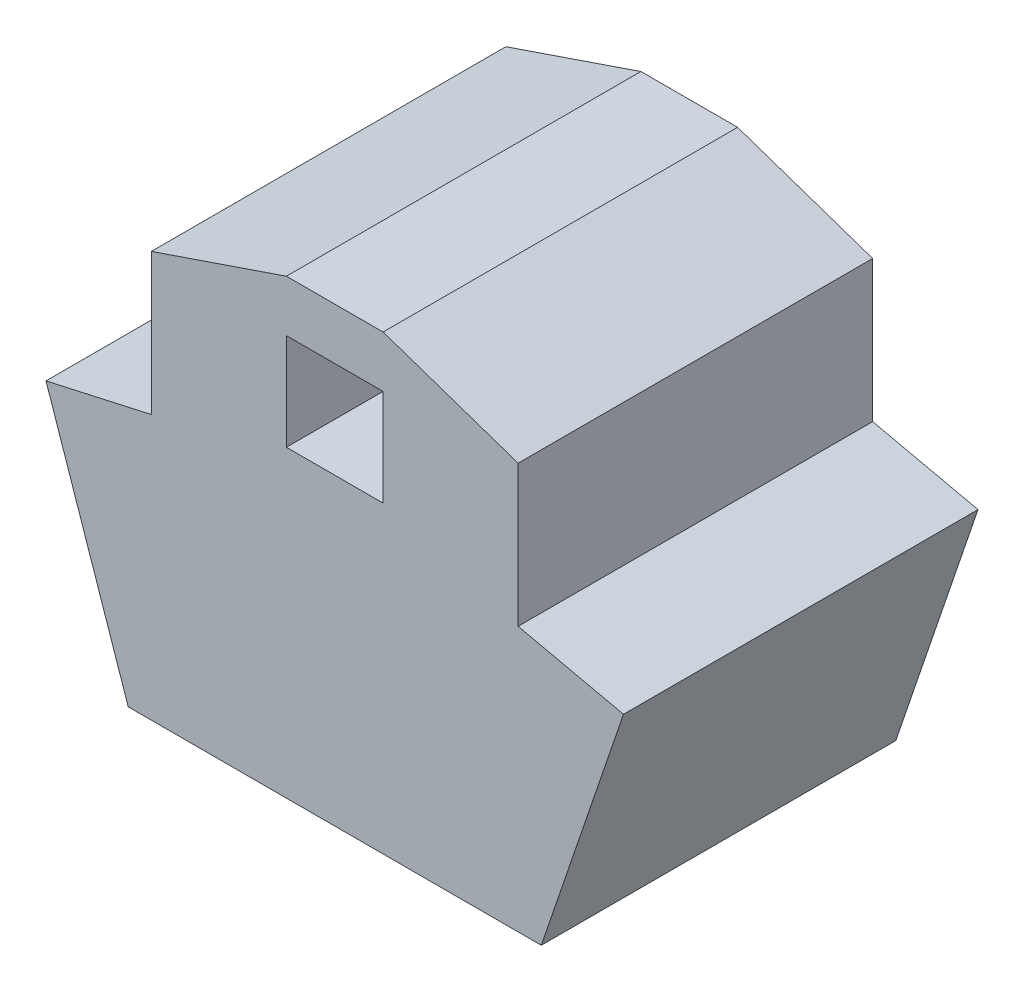
from build123d import *

# Parameters (mm, degrees)
SKETCH1_W                      = 20.045
SKETCH1_H                      = 20.045
BOSS_EXTRUDE1_DEPTH            = 73.5
CUT_EXTRUDE2_DEPTH             = 108.652129543
SKETCH3_RX                     = 9
SKETCH3_RY                     = 5
CUT_EXTRUDE4_DEPTH             = 108.652129543
CUT_EXTRUDE5_DEPTH             = 108.652129714
CUT_EXTRUDE5_DEPTH_BACK        = 108.652129714
SKETCH4_R                      = 7
SKETCH5_R                      = 7
CUT_EXTRUDE6_DEPTH             = 10
CUT_EXTRUDE7_START             = -10
SKETCH6_R                      = 7
CUT_EXTRUDE7_DEPTH             = 10
SKETCH7_R                      = 7.5
CUT_EXTRUDE8_DEPTH             = 10
SKETCH8_R                      = 7
CUT_EXTRUDE9_DEPTH             = 108.652129714
CUT_EXTRUDE9_DIRECTION_2_REACH = 109.652
SKETCH9_R                      = 2.75
CUT_EXTRUDE10_DEPTH            = 15
SKETCH10_R                     = 5.1
CUT_EXTRUDE11_DEPTH            = 4
SKETCH11_W                     = 20.045
SKETCH11_H                     = 20.045
BOSS_EXTRUDE2_DEPTH            = 73.5


with BuildPart() as part:
    # Sketch1 → Boss-Extrude1 (new body)
    with BuildSketch(Plane.XY):
        Polygon((59.861803254, -23.0225), (50.316348709, -51.0225), (-50.316348709, -51.0225), (-59.861803254, -23.0225), (-38.0225, -18.146810718), (-38.0225, 11.146810718), (-10.0225, 20.692265263), (0, 20.692265263), (10.0225, 20.692265263), (38.0225, 11.146810718), (38.0225, -18.146810718), align=None)
        Rectangle(SKETCH1_W, SKETCH1_H, mode=Mode.SUBTRACT)
        Polygon((-12.5, -26.0225), (12.5, -26.0225), (20, -48.0225), (-20, -48.0225), align=None, mode=Mode.SUBTRACT)
        Polygon((15.669537991, -26.0225), (23.169537991, -48.0225), (48.169537991, -48.0225), (55.669537991, -26.0225), align=None, mode=Mode.SUBTRACT)
        Polygon((-15.669537991, -26.0225), (-55.669537991, -26.0225), (-48.169537991, -48.0225), (-23.169537991, -48.0225), align=None, mode=Mode.SUBTRACT)
        Polygon((-13.0225, -23.5), (-13.0225, 16.5), (-35.0225, 9), (-35.0225, -16), align=None, mode=Mode.SUBTRACT)
        Polygon((35.0225, 9), (35.0225, -16), (13.0225, -23.5), (13.0225, 16.5), align=None, mode=Mode.SUBTRACT)
    extrude(amount=BOSS_EXTRUDE1_DEPTH)

    # Sketch2 → Cut-Extrude2 (cut, through all)
    with BuildSketch(Plane.XY):
        Polygon((-17.68804096, -24.0225), (-55.162041129, -24.0225), (-32.517435529, -18.967024579), align=None)
        Polygon((17.68804096, -24.0225), (55.162041129, -24.0225), (32.517435529, -18.967024579), align=None)
    extrude(amount=CUT_EXTRUDE2_DEPTH, mode=Mode.SUBTRACT)

    # Sketch3 → Cut-Extrude4 (cut, through all)
    with BuildSketch(Plane.XY):
        with Locations((0, -18)):
            Ellipse(SKETCH3_RX, SKETCH3_RY)
    extrude(amount=CUT_EXTRUDE4_DEPTH, mode=Mode.SUBTRACT)

    # Sketch4 → Cut-Extrude5 (cut, two sides: drawn at the far end of the back side and taken through both)
    with BuildSketch(Plane(origin=(0, 0, 0), x_dir=(0, 0, -1), z_dir=(1, 0, 0)).offset(-CUT_EXTRUDE5_DEPTH_BACK)):
        with Locations(Location((-36.75, -36.52, 0), (0, 0, 270))):
            Circle(SKETCH4_R)
        with Locations(Location((-58.75, -36.52, 0), (0, 0, 270))):
            Circle(SKETCH4_R)
        with Locations(Location((-14.75, -36.52, 0), (0, 0, 270))):
            Circle(SKETCH4_R)
    extrude(amount=CUT_EXTRUDE5_DEPTH + CUT_EXTRUDE5_DEPTH_BACK, mode=Mode.SUBTRACT)

    # Sketch5 → Cut-Extrude6 (cut)
    with BuildSketch(Plane(origin=(38.0225, 0, 0), x_dir=(0, 0, -1), z_dir=(1, 0, 0))):
        with Locations(Location((-36.75, -3.5, 0), (0, 0, 90))):
            Circle(SKETCH5_R)
        with Locations(Location((-14.75, -3.5, 0), (0, 0, 90))):
            Circle(SKETCH5_R)
        with Locations(Location((-58.75, -3.5, 0), (0, 0, 90))):
            Circle(SKETCH5_R)
    extrude(amount=-CUT_EXTRUDE6_DEPTH, mode=Mode.SUBTRACT)

    # Sketch6 → Cut-Extrude7 (cut)
    with BuildSketch(Plane.ZY.offset(38.0225).offset(CUT_EXTRUDE7_START)):
        with Locations(Location((36.75, -3.5, 0), (0, 0, 90))):
            Circle(SKETCH6_R)
        with Locations(Location((58.75, -3.5, 0), (0, 0, 90))):
            Circle(SKETCH6_R)
        with Locations(Location((14.75, -3.5, 0), (0, 0, 90))):
            Circle(SKETCH6_R)
    extrude(amount=CUT_EXTRUDE7_DEPTH, mode=Mode.SUBTRACT)

    # Sketch7 → Cut-Extrude8 (cut)
    with BuildSketch(Plane.XZ.offset(51.0225)):
        with Locations((0, 36.75)):
            Circle(SKETCH7_R)
        with Locations((35.16, 36.75)):
            Circle(SKETCH7_R)
        with Locations((-35.16, 36.75)):
            Circle(SKETCH7_R)
        with Locations((0, 58.75)):
            Circle(SKETCH7_R)
        with Locations((35.16, 58.75)):
            Circle(SKETCH7_R)
        with Locations((-35.16, 58.75)):
            Circle(SKETCH7_R)
        with Locations((0, 14.75)):
            Circle(SKETCH7_R)
        with Locations((35.16, 14.75)):
            Circle(SKETCH7_R)
        with Locations((-35.16, 14.75)):
            Circle(SKETCH7_R)
    extrude(amount=-CUT_EXTRUDE8_DEPTH, mode=Mode.SUBTRACT)

    # Sketch8 → Cut-Extrude9 (cut)
    with BuildSketch(Plane(origin=(0, 0, 0), x_dir=(1, 0, 0), z_dir=(0, 1, 0))):
        with Locations(Location((23.52, -36.75, 0), (0, 0, 146.422345946))):
            Circle(SKETCH8_R)
        with Locations(Location((23.52, -14.75, 0), (0, 0, 146.422345946))):
            Circle(SKETCH8_R)
        with Locations(Location((23.52, -58.75, 0), (0, 0, 146.422345946))):
            Circle(SKETCH8_R)
        with Locations(Location((-23.52, -58.75, 0), (0, 0, 33.577654054))):
            Circle(SKETCH8_R)
        with Locations(Location((-23.52, -14.75, 0), (0, 0, 33.577654054))):
            Circle(SKETCH8_R)
        with Locations(Location((-23.52, -36.75, 0), (0, 0, 33.577654054))):
            Circle(SKETCH8_R)
    extrude(amount=CUT_EXTRUDE9_DEPTH, mode=Mode.SUBTRACT)

    # Cut-Extrude9 direction 2: up to this face of the body (flat: up to its plane)
    cut_extrude9_direction_2_end = Plane(part.part.faces().sort_by_distance((-36.425041044, -24.0225, 36.75))[0])
    # Sketch8 → Cut-Extrude9 direction 2 (cut, up to the picked face)
    with BuildSketch(Plane(origin=(0, 0, 0), x_dir=(1, 0, 0), z_dir=(0, 1, 0)), mode=Mode.PRIVATE) as cut_extrude9_direction_2_sk1:
        with Locations(Location((23.52, -36.75, 0), (0, 0, 146.422345946))):
            Circle(SKETCH8_R)
    cut_extrude9_direction_2_tool1 = split(extrude(cut_extrude9_direction_2_sk1.sketch, amount=-CUT_EXTRUDE9_DIRECTION_2_REACH, mode=Mode.PRIVATE), bisect_by=cut_extrude9_direction_2_end, keep=Keep.BOTH, mode=Mode.PRIVATE)
    # Sketch8 → Cut-Extrude9 direction 2 (cut, up to the picked face)
    with BuildSketch(Plane(origin=(0, 0, 0), x_dir=(1, 0, 0), z_dir=(0, 1, 0)), mode=Mode.PRIVATE) as cut_extrude9_direction_2_sk2:
        with Locations(Location((23.52, -14.75, 0), (0, 0, 146.422345946))):
            Circle(SKETCH8_R)
    cut_extrude9_direction_2_tool2 = split(extrude(cut_extrude9_direction_2_sk2.sketch, amount=-CUT_EXTRUDE9_DIRECTION_2_REACH, mode=Mode.PRIVATE), bisect_by=cut_extrude9_direction_2_end, keep=Keep.BOTH, mode=Mode.PRIVATE)
    # Sketch8 → Cut-Extrude9 direction 2 (cut, up to the picked face)
    with BuildSketch(Plane(origin=(0, 0, 0), x_dir=(1, 0, 0), z_dir=(0, 1, 0)), mode=Mode.PRIVATE) as cut_extrude9_direction_2_sk3:
        with Locations(Location((23.52, -58.75, 0), (0, 0, 146.422345946))):
            Circle(SKETCH8_R)
    cut_extrude9_direction_2_tool3 = split(extrude(cut_extrude9_direction_2_sk3.sketch, amount=-CUT_EXTRUDE9_DIRECTION_2_REACH, mode=Mode.PRIVATE), bisect_by=cut_extrude9_direction_2_end, keep=Keep.BOTH, mode=Mode.PRIVATE)
    # Sketch8 → Cut-Extrude9 direction 2 (cut, up to the picked face)
    with BuildSketch(Plane(origin=(0, 0, 0), x_dir=(1, 0, 0), z_dir=(0, 1, 0)), mode=Mode.PRIVATE) as cut_extrude9_direction_2_sk4:
        with Locations(Location((-23.52, -58.75, 0), (0, 0, 33.577654054))):
            Circle(SKETCH8_R)
    cut_extrude9_direction_2_tool4 = split(extrude(cut_extrude9_direction_2_sk4.sketch, amount=-CUT_EXTRUDE9_DIRECTION_2_REACH, mode=Mode.PRIVATE), bisect_by=cut_extrude9_direction_2_end, keep=Keep.BOTH, mode=Mode.PRIVATE)
    # Sketch8 → Cut-Extrude9 direction 2 (cut, up to the picked face)
    with BuildSketch(Plane(origin=(0, 0, 0), x_dir=(1, 0, 0), z_dir=(0, 1, 0)), mode=Mode.PRIVATE) as cut_extrude9_direction_2_sk5:
        with Locations(Location((-23.52, -14.75, 0), (0, 0, 33.577654054))):
            Circle(SKETCH8_R)
    cut_extrude9_direction_2_tool5 = split(extrude(cut_extrude9_direction_2_sk5.sketch, amount=-CUT_EXTRUDE9_DIRECTION_2_REACH, mode=Mode.PRIVATE), bisect_by=cut_extrude9_direction_2_end, keep=Keep.BOTH, mode=Mode.PRIVATE)
    # Sketch8 → Cut-Extrude9 direction 2 (cut, up to the picked face)
    with BuildSketch(Plane(origin=(0, 0, 0), x_dir=(1, 0, 0), z_dir=(0, 1, 0)), mode=Mode.PRIVATE) as cut_extrude9_direction_2_sk6:
        with Locations(Location((-23.52, -36.75, 0), (0, 0, 33.577654054))):
            Circle(SKETCH8_R)
    cut_extrude9_direction_2_tool6 = split(extrude(cut_extrude9_direction_2_sk6.sketch, amount=-CUT_EXTRUDE9_DIRECTION_2_REACH, mode=Mode.PRIVATE), bisect_by=cut_extrude9_direction_2_end, keep=Keep.BOTH, mode=Mode.PRIVATE)
    add(cut_extrude9_direction_2_tool1.solids().sort_by(Axis((23.52, 0, 36.75), (0, -1, 0)))[0], mode=Mode.SUBTRACT)
    add(cut_extrude9_direction_2_tool2.solids().sort_by(Axis((23.52, 0, 14.75), (0, -1, 0)))[0], mode=Mode.SUBTRACT)
    add(cut_extrude9_direction_2_tool3.solids().sort_by(Axis((23.52, 0, 58.75), (0, -1, 0)))[0], mode=Mode.SUBTRACT)
    add(cut_extrude9_direction_2_tool4.solids().sort_by(Axis((-23.52, 0, 58.75), (0, -1, 0)))[0], mode=Mode.SUBTRACT)
    add(cut_extrude9_direction_2_tool5.solids().sort_by(Axis((-23.52, 0, 14.75), (0, -1, 0)))[0], mode=Mode.SUBTRACT)
    add(cut_extrude9_direction_2_tool6.solids().sort_by(Axis((-23.52, 0, 36.75), (0, -1, 0)))[0], mode=Mode.SUBTRACT)

    # Sketch9 → Cut-Extrude10 (cut)
    with BuildSketch(Plane(origin=(0, 20.692265263, 0), x_dir=(1, 0, 0), z_dir=(0, 1, 0))):
        with Locations(Location((0, -10, 0), (0, 0, 180))):
            Circle(SKETCH9_R)
        with Locations((0, -63.5)):
            Circle(SKETCH9_R)
    extrude(amount=-CUT_EXTRUDE10_DEPTH, mode=Mode.SUBTRACT)

    # Sketch10 → Cut-Extrude11 (cut)
    with BuildSketch(Plane(origin=(0, 20.692265263, 0), x_dir=(1, 0, 0), z_dir=(0, 1, 0))):
        with Locations(Location((0, -10, 0), (0, 0, 180))):
            Circle(SKETCH10_R)
        with Locations(Location((0, -63.5, 0), (0, 0, 180))):
            Circle(SKETCH10_R)
    extrude(amount=-CUT_EXTRUDE11_DEPTH, mode=Mode.SUBTRACT)

    # Sketch11 → Boss-Extrude2 (add)
    with BuildSketch(Plane.XY):
        Polygon((-50.316348709, -51.0225), (-42.816348709, -73.0225), (42.816348709, -73.0225), (50.316348709, -51.0225), (59.861803254, -23.0225), (38.0225, -18.146810718), (38.0225, 11.146810718), (10.0225, 20.692265263), (-10.0225, 20.692265263), (-38.0225, 11.146810718), (-38.0225, -18.146810718), (-59.861803254, -23.0225), align=None)
        Rectangle(SKETCH11_W, SKETCH11_H, mode=Mode.SUBTRACT)
    extrude(amount=BOSS_EXTRUDE2_DEPTH)


solid = part.part
